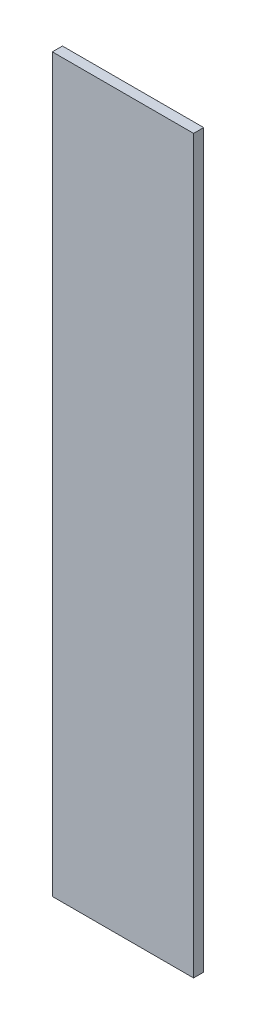
from build123d import *

# Parameters (mm, degrees)
SKETCH1_W           = 177.8
SKETCH1_H           = 920.75
BOSS_EXTRUDE1_DEPTH = 12.7


with BuildPart() as part:
    # Sketch1 → Boss-Extrude1 (new body)
    with BuildSketch(Plane.XY):
        Rectangle(SKETCH1_W, SKETCH1_H)
    extrude(amount=BOSS_EXTRUDE1_DEPTH)


solid = part.part
